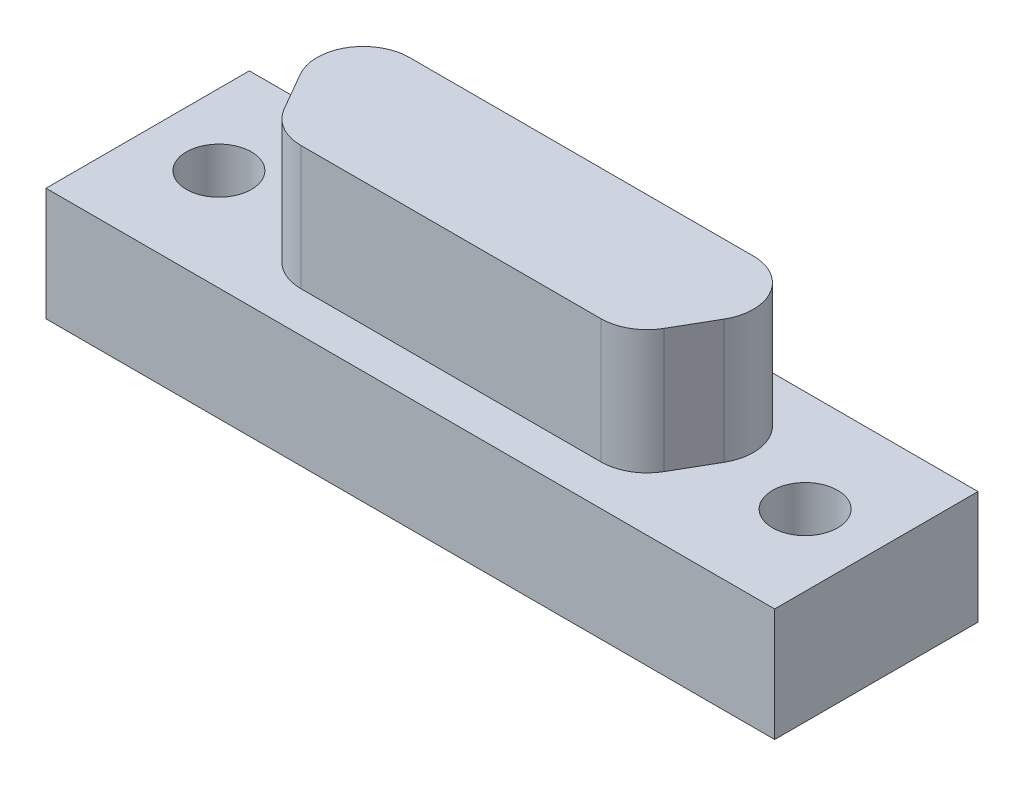
from build123d import *

# Parameters (mm, degrees)
SKETCH1_W           = 27.31
SKETCH1_H           = 7.62
SKETCH1_R           = 1.22
BOSS_EXTRUDE1_DEPTH = 4.24
BOSS_EXTRUDE2_DEPTH = 8.89


with BuildPart() as part:
    # Sketch1 → Boss-Extrude1 (new body)
    with BuildSketch(Plane(origin=(0, 0, 0), x_dir=(1, 0, 0), z_dir=(0, 1, 0))):
        with Locations((13.655, -3.81)):
            Rectangle(SKETCH1_W, SKETCH1_H)
        with BuildLine():
            Line((20.540684506, -5.56), (6.781053245, -5.56))
            ThreePointArc((6.781053245, -5.56), (6.652905637, -5.406873008), (6.543255812, -5.24))
            Line((6.543255812, -5.24), (5.717644927, -3.81))
            ThreePointArc((5.717644927, -3.81), (5.656921043, -3.695054436), (5.605, -3.575873574))
            Line((5.605, -3.575873574), (5.605, -2.314126426))
            ThreePointArc((5.605, -2.314126426), (5.661981888, -2.184516451), (5.729371314, -2.06))
            Line((5.729371314, -2.06), (21.592366437, -2.06))
            ThreePointArc((21.592366437, -2.06), (21.652777263, -2.17041983), (21.705, -2.284939665))
            Line((21.705, -2.284939665), (21.705, -3.605060335))
            ThreePointArc((21.705, -3.605060335), (21.65793272, -3.709197501), (21.604092824, -3.81))
            Line((21.604092824, -3.81), (20.778481939, -5.24))
            ThreePointArc((20.778481939, -5.24), (20.668832114, -5.406873008), (20.540684506, -5.56))
        make_face(mode=Mode.SUBTRACT)
        with Locations((2.67, -3.81)):
            Circle(SKETCH1_R, mode=Mode.SUBTRACT)
        with Locations((24.64, -3.81)):
            Circle(SKETCH1_R, mode=Mode.SUBTRACT)
    extrude(amount=BOSS_EXTRUDE1_DEPTH)

    # Sketch1<2> → Boss-Extrude2 (add)
    with BuildSketch(Plane(origin=(0, 0, 0), x_dir=(1, 0, 0), z_dir=(0, 1, 0))):
        with BuildLine():
            Line((8.04147976, -6.105), (19.28025799, -6.105))
            ThreePointArc((19.28025799, -6.105), (20.14525799, -5.873223949), (20.778481939, -5.24))
            Line((20.778481939, -5.24), (21.604092824, -3.81))
            ThreePointArc((21.604092824, -3.81), (21.604092824, -2.08), (20.105868875, -1.215))
            Line((20.105868875, -1.215), (7.215868875, -1.215))
            ThreePointArc((7.215868875, -1.215), (5.717644927, -2.08), (5.717644927, -3.81))
            Line((5.717644927, -3.81), (6.543255812, -5.24))
            ThreePointArc((6.543255812, -5.24), (7.17647976, -5.873223949), (8.04147976, -6.105))
        make_face()
    extrude(amount=BOSS_EXTRUDE2_DEPTH)


solid = part.part
